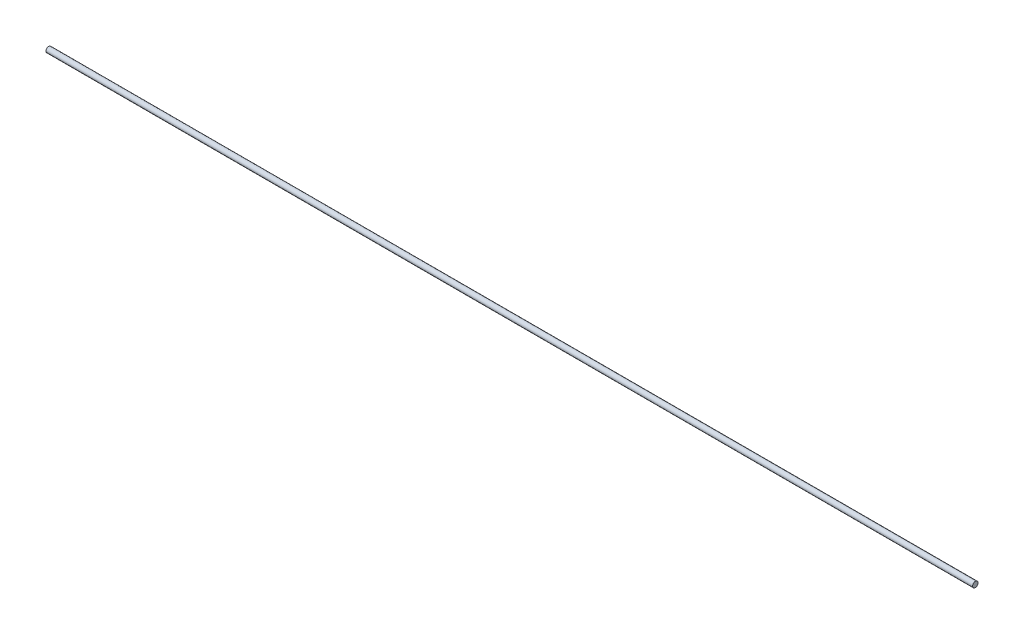
from build123d import *

# Parameters (mm, degrees)
SKETCH_2_R = 1


with BuildPart() as part:
    # 扫描1: sweep along a path in 草图1
    with BuildLine(Plane.XY) as sweep_1_path:
        Line((0, 0), (340, 0))
    # 草图2 → 扫描1 (sweep)
    with BuildSketch(Plane(origin=(0, 0, 0), x_dir=(0, 0, -1), z_dir=(1, 0, 0))):
        Circle(SKETCH_2_R)
    sweep(path=sweep_1_path.line)


solid = part.part
